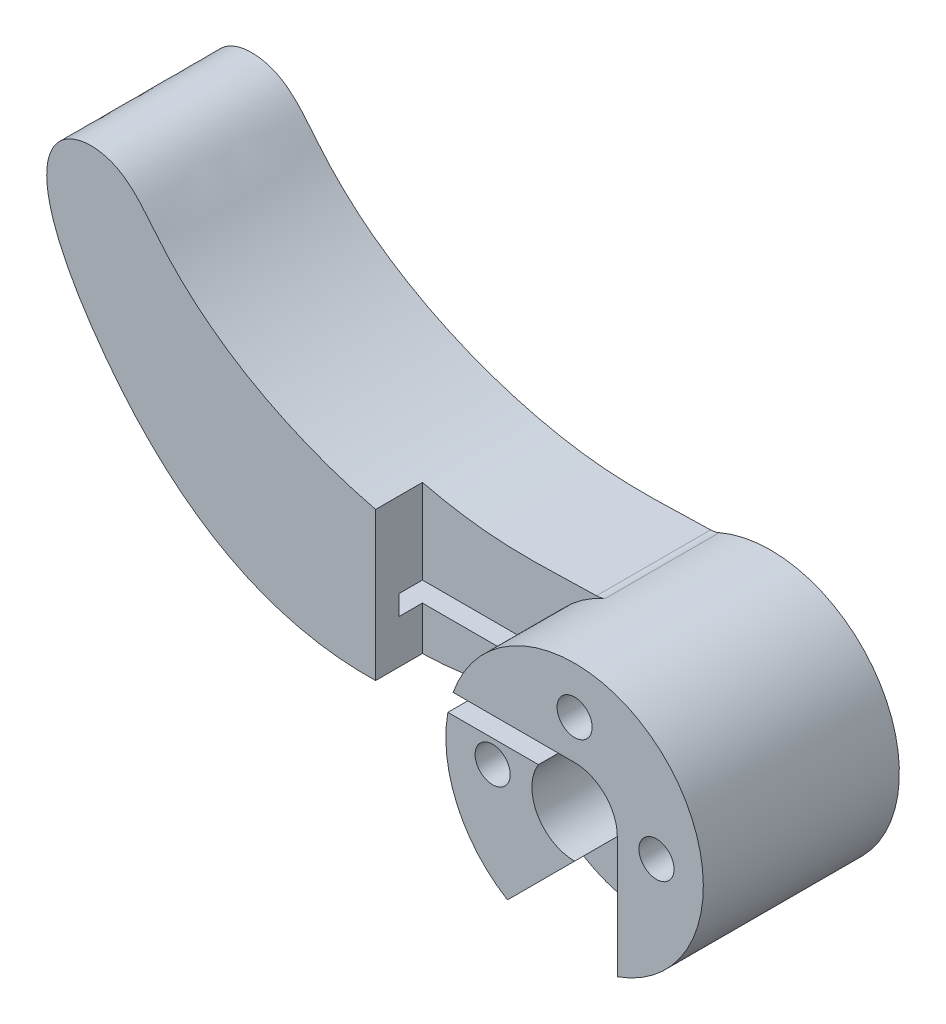
from build123d import *
from build123d.topology import SkipClean

# Parameters (mm, degrees)
EXTRUDE_2_DEPTH          = 54.5
CUT_EXTRUDE_2_DEPTH      = 5
CUT_EXTRUDE_2_DEPTH_BACK = 81.677691421
SKETCH_4_W               = 30
SKETCH_4_H               = 35
EXTRUDE_START            = 4
SKETCH_6_R               = 10
EXTRUDE_3_DEPTH          = 4
SKETCH_8_R               = 2.7
CUT_EXTRUDE_4_DEPTH      = 13.25
SKETCH_5_R               = 1.5
CUT_EXTRUDE_5_DEPTH      = 81.677691421
SKETCH_9_W               = 76.47752339
SKETCH_9_H               = 44.622986838
CUT_EXTRUDE_6_DEPTH      = 40.75
EXTRUDE_5_REACH          = 63.055
SKETCH_14_R              = 11
SKETCH_14_R_2            = 10
CUT_EXTRUDE_7_DEPTH      = 7.5
SKETCH_12_W              = 10
SKETCH_12_H              = 1.7
EXTRUDE_4_DEPTH          = 2
CUT_EXTRUDE_8_DEPTH      = 3.5
FILLET_1_R               = 2
EXTRUDE_START_2          = 3
SKETCH_18_R              = 1.5
EXTRUDE_7_DEPTH          = 3


with BuildPart() as part:
    # 草图3 → 凸台-拉伸2 (new body)
    with BuildSketch(Plane.XY):
        with BuildLine():
            ThreePointArc((-10, -25), (0, -35), (10, -25))
            ThreePointArc((10, -25), (7.071067812, -17.928932188), (0, -15))
            add(Edge.make_bspline(
                [(0, -15), (-7.032534543, -15), (-16.863462039, -16.280132804), (-34.340206182, -9.884235843), (-43.340942555, 3.447882034), (-53.000550404, -1.13586724), (-43, -14.48168932)],
                knots=[0, 0, 0, 0, 0.248294096, 0.674131075, 0.760286187, 1, 1, 1, 1], degree=3))
            add(Edge.make_bspline(
                [(-10, -25), (-23.499770802, -29.331423174), (-34.499770802, -25.825319614), (-43, -14.48168932)],
                knots=[0, 0, 0, 0, 1, 1, 1, 1], degree=3))
        make_face()
    extrude(amount=EXTRUDE_2_DEPTH)

    # 草图4 → 切除-拉伸2 (cut, two sides: drawn at the far end of the back side and taken through both)
    with BuildSketch(Plane(origin=(0, 0, 0), x_dir=(1, 0, 0), z_dir=(0, 1, 0)).offset(-CUT_EXTRUDE_2_DEPTH_BACK)):
        with Locations((-5, -27.25)):
            Rectangle(SKETCH_4_W, SKETCH_4_H)
    extrude(amount=CUT_EXTRUDE_2_DEPTH + CUT_EXTRUDE_2_DEPTH_BACK, mode=Mode.SUBTRACT)

    # 草图6 → 凸台-拉伸3 (add)
    with BuildSketch(Plane(origin=(0, 0, 44.75), x_dir=(-1, 0, 0), z_dir=(0, 0, -1)).offset(EXTRUDE_START)):
        with Locations((0, -25)):
            Circle(SKETCH_6_R)
    extrude_3 = extrude(amount=-EXTRUDE_3_DEPTH)

    # 草图8 → 切除-拉伸4 (cut)
    with BuildSketch(Plane.XY.offset(54.5)):
        with Locations((-7, -25)):
            Circle(SKETCH_8_R)
        with Locations((0, -18)):
            Circle(SKETCH_8_R)
        with Locations((7, -25)):
            Circle(SKETCH_8_R)
    cut_extrude_4 = extrude(amount=-CUT_EXTRUDE_4_DEPTH, mode=Mode.SUBTRACT)

    # 镜向2: 凸台-拉伸3, 切除-拉伸4 across plane
    add(extrude_3.mirror(Plane(origin=(0, 0, 27.25), x_dir=(1, 0, 0), z_dir=(0, 0, -1))))
    add(cut_extrude_4.mirror(Plane(origin=(0, 0, 27.25), x_dir=(1, 0, 0), z_dir=(0, 0, -1))), mode=Mode.SUBTRACT)

    # 草图5 → 切除-拉伸5 (cut, through all)
    with BuildSketch(Plane.XY.offset(54.5)):
        with Locations((0, -18)):
            Circle(SKETCH_5_R)
        with Locations((7, -25)):
            Circle(SKETCH_5_R)
        with Locations((-7, -25)):
            Circle(SKETCH_5_R)
    extrude(amount=-CUT_EXTRUDE_5_DEPTH, mode=Mode.SUBTRACT)

    # 草图9 → 切除-拉伸6 (cut)
    with BuildSketch(Plane.XY.offset(54.5)):
        with Locations((-20.681074519, -19.023937379)):
            Rectangle(SKETCH_9_W, SKETCH_9_H)
    extrude(amount=-CUT_EXTRUDE_6_DEPTH, mode=Mode.SUBTRACT)

    # 凸台-拉伸5: up to this face of the body (flat: up to its plane)
    extrude_5_end = Plane(part.part.faces().sort_by_distance((0, -25.168900804, 13.75))[0])
    # 草图14 → 凸台-拉伸5 (add, up to the picked face)
    with BuildSketch(Plane(origin=(0, 0, 0), x_dir=(-1, 0, 0), z_dir=(0, 0, -1)), mode=Mode.PRIVATE) as extrude_5_sk1:
        with Locations(Location((0, -25, 0), (0, 0, 358.40278085))):
            Circle(SKETCH_14_R)
        with Locations((0, -25)):
            Circle(SKETCH_14_R_2, mode=Mode.SUBTRACT)
    extrude_5_tool1 = split(extrude(extrude_5_sk1.sketch, amount=-EXTRUDE_5_REACH, mode=Mode.PRIVATE), bisect_by=extrude_5_end, keep=Keep.BOTH, mode=Mode.PRIVATE)
    add(extrude_5_tool1.solids().sort_by(Axis((10.68472, -24.702068, 0), (0, 0, 1)))[0])

    # 草图10 → 切除-拉伸7 (cut)
    with BuildSketch(Plane.XY.offset(13.75)):
        with BuildLine():
            Line((0, -21.35), (-30, -21.35))
            Line((-30, -21.35), (-30, -23.05))
            Line((-30, -23.05), (-3.085449724, -23.05))
            ThreePointArc((-3.085449724, -23.05), (1.761391495, -28.196873473), (0, -21.35))
        make_face()
    extrude(amount=-CUT_EXTRUDE_7_DEPTH, mode=Mode.SUBTRACT)

    # 草图12 → 凸台-拉伸4 (add)
    with BuildSketch(Plane.XY.offset(13.75)):
        with Locations((-25, -22.2)):
            Rectangle(SKETCH_12_W, SKETCH_12_H)
    extrude(amount=-EXTRUDE_4_DEPTH)

    # 草图15 → 切除-拉伸8 (cut)
    with BuildSketch(Plane.XY.offset(13.75)):
        Polygon((3.65, -25), (3.65, -41.029929672), (-9.565125757, -38.215125757), align=None)
    extrude(amount=-CUT_EXTRUDE_8_DEPTH, mode=Mode.SUBTRACT)

    # 圆角1
    fillet_1_edges = [part.edges().sort_by_distance(p)[0] for p in [
        (-10.995726159, -25.306604349, 4.875),
        (-4.726026293, -15.066990613, 4.875),
    ]]
    fillet(fillet_1_edges, radius=FILLET_1_R)

    # 草图18 → 凸台-拉伸7 (add)
    # profile 1 of 2: a face of its own
    with SkipClean():  # the faces are left unmerged after this step: merging them gives an invalid solid
        with BuildSketch(Plane.XY.offset(13.75).offset(EXTRUDE_START_2)):
            with BuildLine():
                Line((3.65, -25), (3.65, -35.376776956))
                ThreePointArc((3.65, -35.376776956), (7.778174593, -17.221825407), (-10.376776956, -21.35))
                Line((-10.376776956, -21.35), (0, -21.35))
                ThreePointArc((0, -21.35), (2.580939751, -22.419060249), (3.65, -25))
            make_face()
            with Locations((7, -25)):
                Circle(SKETCH_18_R, mode=Mode.SUBTRACT)
            with Locations((0, -18)):
                Circle(SKETCH_18_R, mode=Mode.SUBTRACT)
        # profile 2 of 2: a face of its own
        with BuildSketch(Plane.XY.offset(13.75).offset(EXTRUDE_START_2)):
            with BuildLine():
                Line((-5.736043248, -34.386043248), (0, -28.65))
                ThreePointArc((0, -28.65), (-3.196873473, -26.761391495), (-3.085449724, -23.05))
                Line((-3.085449724, -23.05), (-10.825779418, -23.05))
                ThreePointArc((-10.825779418, -23.05), (-10.034937052, -29.505556388), (-5.736043248, -34.386043248))
            make_face()
            with Locations((-7, -25)):
                Circle(SKETCH_18_R, mode=Mode.SUBTRACT)
        extrude(amount=-EXTRUDE_7_DEPTH)


solid = part.part
